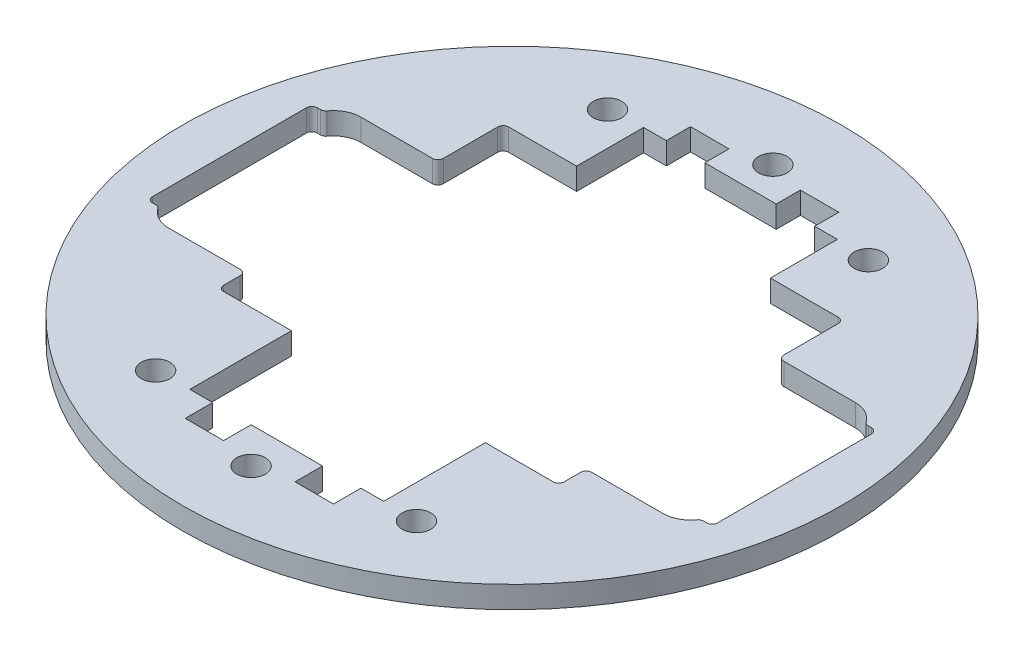
from build123d import *

# Parameters (mm, degrees)
SKETCH_1_R               = 54.5
EXTRUDE_1_DEPTH          = 4
SKETCH_2_W               = 100
SKETCH_2_H               = 35
CUT_EXTRUDE_1_DEPTH      = 4
FILLET_1_R               = 5
SKETCH_3_R               = 2.6
CUT_EXTRUDE_2_DEPTH      = 10
PATTERN_CIRCULAR_1_COUNT = 2
SKETCH_4_R               = 2.6
CUT_EXTRUDE_3_DEPTH      = 10
SKETCH_5_R               = 2.6
CUT_EXTRUDE_4_DEPTH      = 100
SKETCH_6_W               = 35.3
SKETCH_6_H               = 19.5
SKETCH_6_R               = 2.6
SKETCH_6_H_2             = 1.5
CUT_EXTRUDE_5_DEPTH      = 10
CUT_EXTRUDE_6_DEPTH      = 10
FILLET_2_R               = 1
SKETCH_8_W               = 35.3
SKETCH_8_H               = 3.1
CUT_EXTRUDE_7_DEPTH      = 10
SKETCH_10_W              = 35.3
SKETCH_10_H              = 4
CUT_EXTRUDE_8_DEPTH      = 54.5
SKETCH_11_R              = 56.5
SKETCH_11_R_2            = 54.5
EXTRUDE_2_DEPTH          = 4
SKETCH_12_W              = 3.5
SKETCH_12_H              = 5
CUT_EXTRUDE_9_DEPTH      = 6
PATTERN_CIRCULAR_2_COUNT = 2
SKETCH_14_W              = 102.88
SKETCH_14_H              = 30
CUT_EXTRUDE_10_DEPTH     = 30
FILLET_3_R               = 1
SKETCH_15_R              = 60
SKETCH_15_R_2            = 56.5
EXTRUDE_3_DEPTH          = 4


with BuildPart() as part:
    # 草图1 → 凸台-拉伸1 (new body)
    with BuildSketch(Plane(origin=(0, 0, 0), x_dir=(1, 0, 0), z_dir=(0, 1, 0))):
        with Locations(Location((0, 0, 0), (0, 0, 270))):
            Circle(SKETCH_1_R)
    extrude(amount=EXTRUDE_1_DEPTH)

    # 草图2 → 切除-拉伸1 (cut)
    with BuildSketch(Plane(origin=(0, 4, 0), x_dir=(1, 0, 0), z_dir=(0, 1, 0))):
        Rectangle(SKETCH_2_W, SKETCH_2_H)
    extrude(amount=-CUT_EXTRUDE_1_DEPTH, mode=Mode.SUBTRACT)

    # 圆角1
    fillet_1_edges = [part.edges().sort_by_distance(p)[0] for p in [
        (50, 2, -17.5),
        (50, 2, 17.5),
        (-50, 2, 17.5),
        (-50, 2, -17.5),
    ]]
    fillet(fillet_1_edges, radius=FILLET_1_R)

    # 草图3 → 切除-拉伸2 (cut)
    with BuildSketch(Plane.XZ):
        with Locations(Location((-23.75, 41.13620668, 0), (0, 0, 270))):
            Circle(SKETCH_3_R)
        with Locations(Location((23.75, 41.13620668, 0), (0, 0, 270))):
            Circle(SKETCH_3_R)
        with Locations(Location((0, 47.5, 0), (0, 0, 270))):
            Circle(SKETCH_3_R)
    cut_extrude_2 = extrude(amount=-CUT_EXTRUDE_2_DEPTH, mode=Mode.SUBTRACT)

    # 阵列(圆周)1: 切除-拉伸2 ×2 about axis
    pattern_circular_1_axis = Axis((0, 0, 0), (0, 1, 0))
    for i in range(1, PATTERN_CIRCULAR_1_COUNT):
        add(cut_extrude_2.rotate(pattern_circular_1_axis, i * 360 / PATTERN_CIRCULAR_1_COUNT), mode=Mode.SUBTRACT)

    # 草图4 → 切除-拉伸3 (cut)
    with BuildSketch(Plane.XZ):
        with Locations(Location((-15, 29.5, 0), (0, 0, 270))):
            Circle(SKETCH_4_R)
        with Locations(Location((15, 29.5, 0), (0, 0, 270))):
            Circle(SKETCH_4_R)
    extrude(amount=-CUT_EXTRUDE_3_DEPTH, mode=Mode.SUBTRACT)

    # 草图5 → 切除-拉伸4 (cut)
    with BuildSketch(Plane.XZ):
        with Locations(Location((-15, -33.5, 0), (0, 0, 270))):
            Circle(SKETCH_5_R)
        with Locations(Location((15, -33.5, 0), (0, 0, 270))):
            Circle(SKETCH_5_R)
    extrude(amount=-CUT_EXTRUDE_4_DEPTH, mode=Mode.SUBTRACT)

    # 草图6 → 切除-拉伸5 (cut)
    # profile 1 of 3: a face of its own
    with BuildSketch(Plane.XZ):
        with Locations((0, -27.25)):
            Rectangle(SKETCH_6_W, SKETCH_6_H)
        with Locations((-15, -33.5)):
            Circle(SKETCH_6_R, mode=Mode.SUBTRACT)
        with Locations((15, -33.5)):
            Circle(SKETCH_6_R, mode=Mode.SUBTRACT)
    # profile 2 of 3: a face of its own
    with BuildSketch(Plane.XZ):
        with Locations((0, -37.75)):
            Rectangle(SKETCH_6_W, SKETCH_6_H_2)
    # profile 3 of 3: a face of its own
    with BuildSketch(Plane.XZ):
        with Locations((0, 27.25)):
            Rectangle(SKETCH_6_W, SKETCH_6_H)
        with Locations((-15, 29.5)):
            Circle(SKETCH_6_R, mode=Mode.SUBTRACT)
        with Locations((15, 29.5)):
            Circle(SKETCH_6_R, mode=Mode.SUBTRACT)
    extrude(amount=-CUT_EXTRUDE_5_DEPTH, mode=Mode.SUBTRACT)

    # 草图7 → 切除-拉伸6 (cut)
    with BuildSketch(Plane.XZ):
        Polygon((-31, 22.5), (31, 22.5), (31, -22.5), (31, -29.4), (-31, -29.4), (-31, -22.5), align=None)
    extrude(amount=-CUT_EXTRUDE_6_DEPTH, mode=Mode.SUBTRACT)

    # 圆角2
    fillet_2_edges = [part.edges().sort_by_distance(p)[0] for p in [
        (31, 2, -17.5),
        (-31, 2, -17.5),
        (-31, 2, 17.5),
        (31, 2, 22.5),
        (31, 2, 17.5),
        (-31, 2, 22.5),
        (31, 2, -29.4),
        (-31, 2, -29.4),
    ]]
    fillet(fillet_2_edges, radius=FILLET_2_R)

    # 草图8 → 切除-拉伸7 (cut)
    with BuildSketch(Plane.XZ):
        with Locations((0, -40.05)):
            Rectangle(SKETCH_8_W, SKETCH_8_H)
    extrude(amount=-CUT_EXTRUDE_7_DEPTH, mode=Mode.SUBTRACT)

    # 草图10 → 切除-拉伸8 (cut)
    with BuildSketch(Plane.XZ):
        with Locations((0, 39)):
            Rectangle(SKETCH_10_W, SKETCH_10_H)
    extrude(amount=-CUT_EXTRUDE_8_DEPTH, mode=Mode.SUBTRACT)

    # 草图11 → 凸台-拉伸2 (add)
    with BuildSketch(Plane.XZ):
        with Locations(Location((0, 0, 0), (0, 0, 270))):
            Circle(SKETCH_11_R)
        Circle(SKETCH_11_R_2, mode=Mode.SUBTRACT)
    extrude(amount=-EXTRUDE_2_DEPTH)

    # 草图12 → 切除-拉伸9 (cut)
    with BuildSketch(Plane.XZ):
        with Locations((-8.25, 43.5)):
            Rectangle(SKETCH_12_W, SKETCH_12_H)
        with Locations((-11.75, 43.5)):
            Rectangle(SKETCH_12_W, SKETCH_12_H)
        with Locations((8.25, 43.5)):
            Rectangle(SKETCH_12_W, SKETCH_12_H)
        with Locations((11.75, 43.5)):
            Rectangle(SKETCH_12_W, SKETCH_12_H)
    cut_extrude_9 = extrude(amount=-CUT_EXTRUDE_9_DEPTH, mode=Mode.SUBTRACT)

    # 阵列(圆周)2: 切除-拉伸9 ×2 about axis
    pattern_circular_2_axis = Axis((0, 0, 0), (0, 1, 0))
    for i in range(1, PATTERN_CIRCULAR_2_COUNT):
        add(cut_extrude_9.rotate(pattern_circular_2_axis, i * 360 / PATTERN_CIRCULAR_2_COUNT), mode=Mode.SUBTRACT)

    # 草图14 → 切除-拉伸10 (cut)
    with BuildSketch(Plane(origin=(0, 0, 0), x_dir=(-1, 0, 0), z_dir=(0, -1, 0))):
        Rectangle(SKETCH_14_W, SKETCH_14_H)
    extrude(amount=-CUT_EXTRUDE_10_DEPTH, mode=Mode.SUBTRACT)

    # 圆角3
    fillet_3_edges = [part.edges().sort_by_distance(p)[0] for p in [
        (-49.330127019, 2, -15),
        (49.330127019, 2, 15),
        (-51.44, 2, 15),
        (-49.330127019, 2, 15),
        (51.44, 2, -15),
        (49.330127019, 2, -15),
        (-51.44, 2, -15),
        (51.44, 2, 15),
    ]]
    fillet(fillet_3_edges, radius=FILLET_3_R)

    # 草图15 → 凸台-拉伸3 (add)
    with BuildSketch(Plane.XZ):
        with Locations(Location((0, 0, 0), (0, 0, 270))):
            Circle(SKETCH_15_R)
        Circle(SKETCH_15_R_2, mode=Mode.SUBTRACT)
    extrude(amount=-EXTRUDE_3_DEPTH)


solid = part.part
